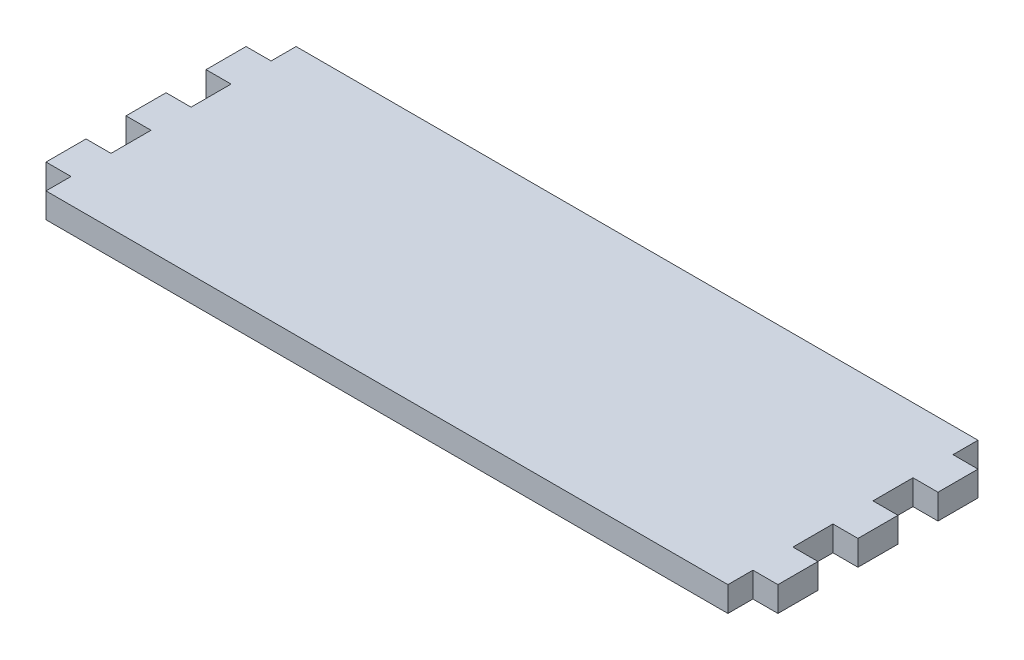
from build123d import *

# Parameters (mm, degrees)
RESSALTO_EXTRUS_O1_DEPTH = 3


with BuildPart() as part:
    # Esboço1 → Ressalto-extrusão1 (new body)
    with BuildSketch(Plane(origin=(0, 0, 0), x_dir=(1, 0, 0), z_dir=(0, 1, 0))):
        Polygon((-65.519336239, 7.741811902), (-62.519336239, 7.741811902), (-62.519336239, 10.741811902), (19.280663761, 10.741811902), (19.280663761, 7.741811902), (22.280663761, 7.741811902), (22.280663761, 2.941811902), (19.280663761, 2.941811902), (19.280663761, -1.858188098), (22.280663761, -1.858188098), (22.280663761, -6.658188098), (19.280663761, -6.658188098), (19.280663761, -11.458188098), (22.280663761, -11.458188098), (22.280663761, -16.258188098), (19.280663761, -16.258188098), (19.280663761, -19.258188098), (-62.519336239, -19.258188098), (-62.519336239, -16.258188098), (-65.519336239, -16.258188098), (-65.519336239, -11.458188098), (-62.519336239, -11.458188098), (-62.519336239, -6.658188098), (-65.519336239, -6.658188098), (-65.519336239, -1.858188098), (-62.519336239, -1.858188098), (-62.519336239, 2.941811902), (-65.519336239, 2.941811902), align=None)
    extrude(amount=RESSALTO_EXTRUS_O1_DEPTH)


solid = part.part
